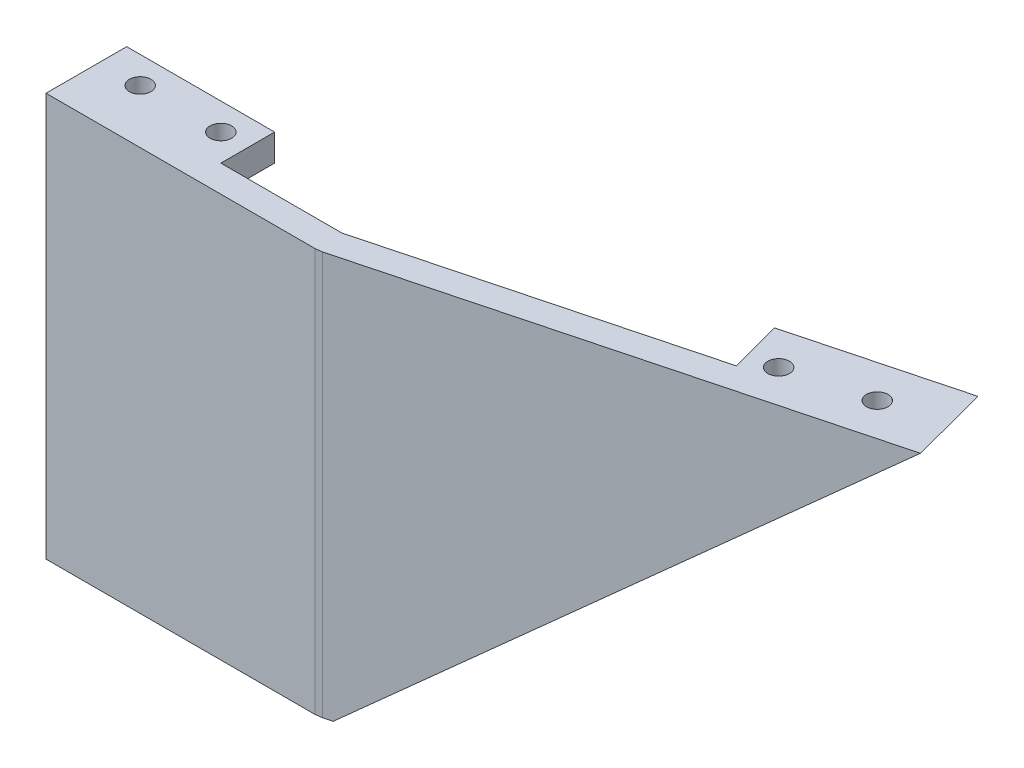
from build123d import *

# Parameters (mm, degrees)
SKETCH_1_W          = 50
SKETCH_1_H          = 150
EXTRUDE_1_DEPTH     = 10
SKETCH_3_W          = 10
SKETCH_3_H          = 150
EXTRUDE_2_DEPTH     = 280
EXTRUDE_3_DEPTH     = 10
CUT_EXTRUDE_1_DEPTH = 50
EXTRUDE_4_DEPTH     = 50
SKETCH_9_R          = 4
CUT_EXTRUDE_2_DEPTH = 30
CUT_EXTRUDE_4_DEPTH = 10


with BuildPart() as part:
    # 草图1 → 凸台-拉伸1 (new body)
    with BuildSketch(Plane.XY):
        Rectangle(SKETCH_1_W, SKETCH_1_H)
    extrude(amount=EXTRUDE_1_DEPTH)



with BuildPart() as body_2:
    # 草图3 → 凸台-拉伸2 (new body)
    with BuildSketch(Plane(origin=(25, 75, 0), x_dir=(-0.2544932992796438, 0, -0.9670745372626465), z_dir=(0.9670745372626465, 0, -0.2544932992796438))):
        with Locations((-5, -75)):
            Rectangle(SKETCH_3_W, SKETCH_3_H)
    extrude(amount=EXTRUDE_2_DEPTH)


with BuildPart() as part_1:
    add(part.part)

    add(body_2.part)  # 放样8 merges body 2
    # 草图4 → 放样8 section 0
    with BuildSketch(Plane(origin=(25, 0, 0), x_dir=(0, 0, -1), z_dir=(1, 0, 0))):
        with BuildLine():
            Line((-10, 75), (0, 75))
            Line((0, 75), (0, -75))
            Line((0, -75), (-10, -75))
            Line((-10, -75), (-10, 75))
        make_face()
    # 草图5 → 放样8 section 1
    with BuildSketch(Plane(origin=(23.380829016, 0, -6.152849741), x_dir=(0.25449329927964376, 0, 0.9670745372626466), z_dir=(-0.9670745372626466, 0, 0.25449329927964376))):
        with BuildLine():
            Line((6.362332482, 75), (16.362332482, 75))
            Line((16.362332482, 75), (16.362332482, -75))
            Line((16.362332482, -75), (6.362332482, -75))
            Line((6.362332482, -75), (6.362332482, 75))
        make_face()
    loft()

    # 草图6 → 凸台-拉伸3 (add)
    with BuildSketch(Plane(origin=(0, 75, 0), x_dir=(1, 0, 0), z_dir=(0, 1, 0))):
        Polygon((25, 0), (295.780870434, 71.258123798), (290.691004448, 90.599614544), (22.412469182, 20), (-25, 20), (-25, 0), align=None)
    extrude(amount=-EXTRUDE_3_DEPTH)

    # 草图7 → 切除-拉伸1 (cut, symmetric)
    with BuildSketch(Plane(origin=(1.619170984, 0, 6.152849741), x_dir=(-0.9670745372626465, 0, 0.2544932992796438), z_dir=(-0.2544932992796438, 0, -0.9670745372626465))):
        Polygon((-194.176863432, 65), (-24.176863432, -77.6469373), (26.721796424, -75), (44.26157498, -115.472113567), (-316.323525899, -105.286880986), (-321.035103343, 79.29609417), (-302.302762067, 102.681692196), (-235.315396996, 89.416867429), (-227.148078723, 92.666134591), align=None)
    extrude(amount=CUT_EXTRUDE_1_DEPTH, both=True, mode=Mode.SUBTRACT)

    # 草图8 → 凸台-拉伸4 (add)
    with BuildSketch(Plane.ZY.offset(25)):
        Polygon((0, 65), (0, -75), (10, -75), (10, 75), (-20, 75), (-20, 65), align=None)
    extrude(amount=EXTRUDE_4_DEPTH)

    # 草图9 → 切除-拉伸2 (cut)
    with BuildSketch(Plane.XZ.offset(-65)):
        with Locations(Location((-60, -10, 0), (0, 0, 270))):
            Circle(SKETCH_9_R)
        with Locations(Location((-30, -10, 0), (0, 0, 270))):
            Circle(SKETCH_9_R)
        with Locations(Location((178.459459466, -45.554300571, 0), (0, 0, 270))):
            Circle(SKETCH_9_R)
        with Locations(Location((149.447223348, -37.919501593, 0), (0, 0, 270))):
            Circle(SKETCH_9_R)
    extrude(amount=-CUT_EXTRUDE_2_DEPTH, mode=Mode.SUBTRACT)

    # 草图10 → 切除-拉伸4 (cut)
    with BuildSketch(Plane(origin=(0, 75, 0), x_dir=(1, 0, 0), z_dir=(0, 1, 0))):
        Polygon((141.048944472, 30.539195914), (135.959078486, 49.880686659), (22.412469182, 20), (-20, 20), (-20, 0), (25, 0), align=None)
    extrude(amount=-CUT_EXTRUDE_4_DEPTH, mode=Mode.SUBTRACT)


solid = part_1.part
